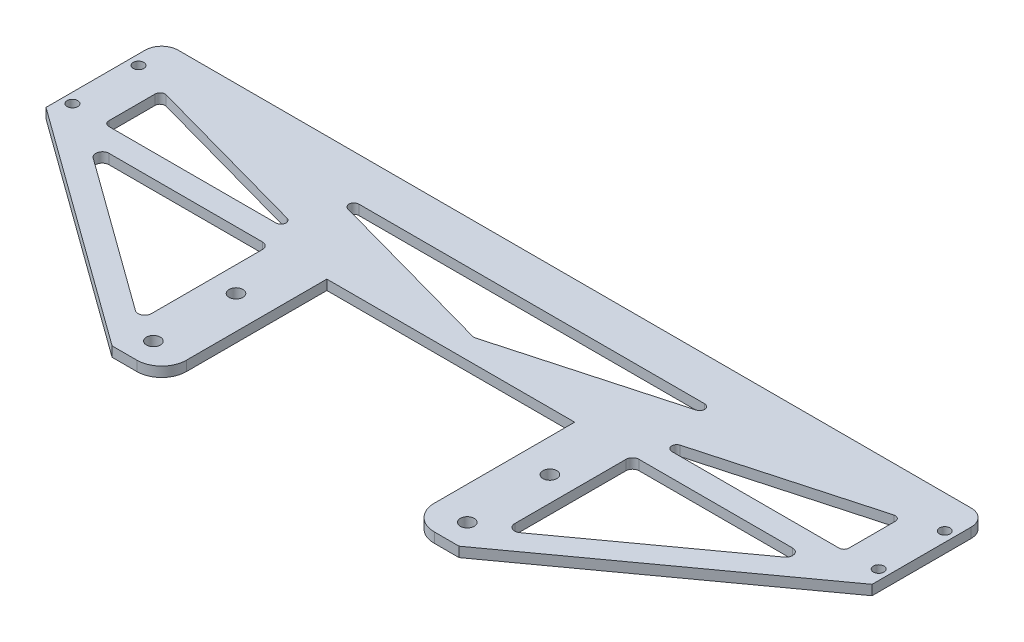
from build123d import *

# Parameters (mm, degrees)
SKETCH_1_R          = 1.6
SKETCH_1_R_2        = 2.1
EXTRUDE_1_DEPTH     = 3
FILLET_1_R          = 5
FILLET_2_R          = 7.5
CUT_EXTRUDE_1_DEPTH = 254.622258487


with BuildPart() as part:
    # 草图1 → 凸台-拉伸1 (new body)
    with BuildSketch(Plane(origin=(0, 0, 0), x_dir=(1, 0, 0), z_dir=(0, 1, 0))):
        Polygon((-3, 30), (-3, -5), (69.5, -57.5), (84.5, -57.5), (84.5, -7.5), (159.5, -7.5), (159.5, -57.5), (174.5, -57.5), (247, -5), (247, 30), align=None)
        with Locations(Location((0, 20, 0), (0, 0, 270))):
            Circle(SKETCH_1_R, mode=Mode.SUBTRACT)
        with Locations(Location((0, 0, 0), (0, 0, 270))):
            Circle(SKETCH_1_R, mode=Mode.SUBTRACT)
        with Locations(Location((244, 20, 0), (0, 0, 270))):
            Circle(SKETCH_1_R, mode=Mode.SUBTRACT)
        with Locations(Location((244, 0, 0), (0, 0, 270))):
            Circle(SKETCH_1_R, mode=Mode.SUBTRACT)
        with Locations(Location((74.5, -25, 0), (0, 0, 270))):
            Circle(SKETCH_1_R_2, mode=Mode.SUBTRACT)
        with Locations(Location((169.5, -25, 0), (0, 0, 270))):
            Circle(SKETCH_1_R_2, mode=Mode.SUBTRACT)
        with Locations(Location((74.5, -50, 0), (0, 0, 270))):
            Circle(SKETCH_1_R_2, mode=Mode.SUBTRACT)
        with Locations(Location((169.5, -50, 0), (0, 0, 270))):
            Circle(SKETCH_1_R_2, mode=Mode.SUBTRACT)
        with BuildLine():
            Line((18.559297534, -7.5), (65, -7.5))
            ThreePointArc((65, -7.5), (66.414213562, -8.085786438), (67, -9.5))
            Line((67, -9.5), (67, -43.129474199))
            ThreePointArc((67, -43.129474199), (65.909384614, -44.910771374), (63.826980376, -44.749358442))
            Line((63.826980376, -44.749358442), (17.38627791, -11.119884243))
            ThreePointArc((17.38627791, -11.119884243), (16.656698196, -8.883464716), (18.559297534, -7.5))
        make_face(mode=Mode.SUBTRACT)
        with BuildLine():
            Line((180.173019624, -44.749358442), (226.61372209, -11.119884243))
            ThreePointArc((226.61372209, -11.119884243), (227.343301804, -8.883464716), (225.440702466, -7.5))
            Line((225.440702466, -7.5), (179, -7.5))
            ThreePointArc((179, -7.5), (177.585786438, -8.085786438), (177, -9.5))
            Line((177, -9.5), (177, -43.129474199))
            ThreePointArc((177, -43.129474199), (178.090615386, -44.910771374), (180.173019624, -44.749358442))
        make_face(mode=Mode.SUBTRACT)
    extrude(amount=EXTRUDE_1_DEPTH)

    # 圆角1
    fillet_1_edges = [part.edges().sort_by_distance(p)[0] for p in [
        (247, 1.5, -30),
        (-3, 1.5, -30),
    ]]
    fillet(fillet_1_edges, radius=FILLET_1_R)

    # 圆角2
    fillet_2_edges = [part.edges().sort_by_distance(p)[0] for p in [
        (159.5, 1.5, 57.5),
        (84.5, 1.5, 57.5),
    ]]
    fillet(fillet_2_edges, radius=FILLET_2_R)

    # 草图3 → 切除-拉伸1 (cut, through all)
    with BuildSketch(Plane(origin=(0, 3, 0), x_dir=(1, 0, 0), z_dir=(0, 1, 0))):
        with BuildLine():
            Line((10, 15.02762992), (10, 1))
            ThreePointArc((10, 1), (10.439339828, -0.060660172), (11.5, -0.5))
            Line((11.5, -0.5), (62.104084647, -0.5))
            ThreePointArc((62.104084647, -0.5), (63.590394858, 0.79780713), (62.50477975, 2.445490724))
            Line((62.50477975, 2.445490724), (11.900695103, 16.473120645))
            ThreePointArc((11.900695103, 16.473120645), (10.591991921, 16.221581899), (10, 15.02762992))
        make_face()
        with BuildLine():
            Line((69.691860168, 17), (174.308139832, 17))
            ThreePointArc((174.308139832, 17), (175.794450043, 15.70219287), (174.708834935, 14.054509276))
            Line((174.708834935, 14.054509276), (122.400695103, -0.445490724))
            ThreePointArc((122.400695103, -0.445490724), (122, -0.5), (121.599304897, -0.445490724))
            Line((121.599304897, -0.445490724), (69.291165065, 14.054509276))
            ThreePointArc((69.291165065, 14.054509276), (68.205549957, 15.70219287), (69.691860168, 17))
        make_face()
        with BuildLine():
            Line((232.5, -0.5), (181.895915353, -0.5))
            ThreePointArc((181.895915353, -0.5), (180.409605142, 0.79780713), (181.49522025, 2.445490724))
            Line((181.49522025, 2.445490724), (232.099304897, 16.473120645))
            ThreePointArc((232.099304897, 16.473120645), (233.408008079, 16.221581899), (234, 15.02762992))
            Line((234, 15.02762992), (234, 1))
            ThreePointArc((234, 1), (233.560660172, -0.060660172), (232.5, -0.5))
        make_face()
    extrude(amount=-CUT_EXTRUDE_1_DEPTH, mode=Mode.SUBTRACT)


solid = part.part
